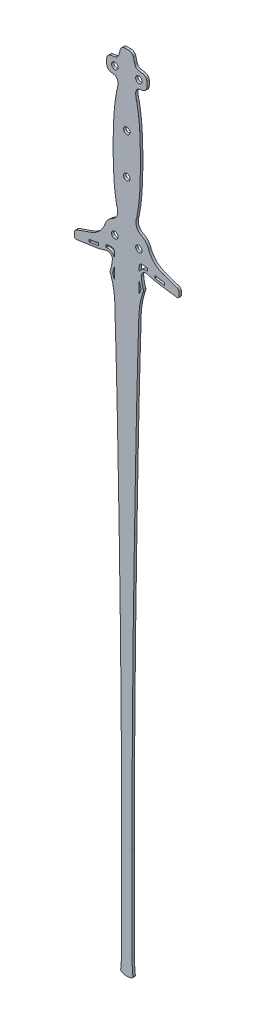
from build123d import *

# Parameters (mm, degrees)
SKETCH_1_R      = 4.005
EXTRUDE_1_DEPTH = 1.5
FILLET_1_R      = 0.2
FILLET_2_R      = 3


with BuildPart() as part:
    # 草图1 → 凸台-拉伸1 (new, symmetric)
    # profile 1 of 2: a face of its own
    with BuildSketch(Plane.XY):
        with BuildLine():
            Line((-51, 3.180546414), (-51, 7.9))
            Line((-51, 7.9), (-62.321401699, 3.937509405))
            ThreePointArc((-62.321401699, 3.937509405), (-64.262330976, 2.47663784), (-65, 0.16207598))
            Line((-65, 0.16207598), (-65, -4.695641523))
            ThreePointArc((-65, -4.695641523), (-64.310942264, -6.206081982), (-62.718569619, -6.675741757))
            Line((-62.718569619, -6.675741757), (-40, -3.446765969))
            ThreePointArc((-40, -3.446765969), (-32.913575006, -2.074422171), (-26, 0))
            ThreePointArc((-26, 0), (-20.389974874, -0.853299832), (-18, -6))
            ThreePointArc((-18, -6), (-18.819913687, -12.424591758), (-20.517307458, -18.674911117))
            ThreePointArc((-20.517307458, -18.674911117), (-20.73865282, -20.013363651), (-20.499895698, -21.348820124))
            ThreePointArc((-20.499895698, -21.348820124), (-16.618295339, -35.457177445), (-15, -50))
            ThreePointArc((-15, -50), (-12.720169014, -129.993004226), (-11, -210.000000002))
            Line((-11, -210.000000002), (-9.559920685, -290.000000002))
            ThreePointArc((-9.559920685, -290.000000002), (-7.264995661, -459.993115498), (-6.5, -630.000000001))
            Line((-6.5, -630.000000001), (-6.5, -745))
            ThreePointArc((-6.5, -745), (-6.775179744, -755.763553595), (-7.6, -766.498984719))
            ThreePointArc((-7.6, -766.498984719), (-7.236288831, -768.028603861), (-6, -769))
            ThreePointArc((-6, -769), (-3.041381265, -769.748287591), (0, -770))
            ThreePointArc((0, -770), (3.041381265, -769.748287591), (6, -769))
            ThreePointArc((6, -769), (7.236288831, -768.028603861), (7.6, -766.498984719))
            ThreePointArc((7.6, -766.498984719), (6.775179744, -755.763553595), (6.5, -745))
            Line((6.5, -745), (6.5, -630.000000001))
            ThreePointArc((6.5, -630.000000001), (7.264995661, -459.993115498), (9.559920685, -290.000000002))
            Line((9.559920685, -290.000000002), (11, -210.000000002))
            ThreePointArc((11, -210.000000002), (12.720169014, -129.993004226), (15, -50))
            ThreePointArc((15, -50), (16.618295339, -35.457177445), (20.499895698, -21.348820124))
            ThreePointArc((20.499895698, -21.348820124), (20.73865282, -20.013363651), (20.517307458, -18.674911117))
            ThreePointArc((20.517307458, -18.674911117), (18.819913687, -12.424591758), (18, -6))
            ThreePointArc((18, -6), (20.389974874, -0.853299832), (26, 0))
            ThreePointArc((26, 0), (32.913575005, -2.074422171), (40, -3.446765969))
            Line((40, -3.446765969), (62.718569618, -6.675741757))
            ThreePointArc((62.718569618, -6.675741757), (64.310942264, -6.206081982), (65, -4.695641522))
            Line((65, -4.695641522), (65, 0.16207598))
            ThreePointArc((65, 0.16207598), (64.262330976, 2.47663784), (62.321401699, 3.937509405))
            Line((62.321401699, 3.937509405), (51, 7.9))
            Line((51, 7.9), (51.000000001, 3.180546413))
            ThreePointArc((51.000000001, 3.180546413), (50.30127228, 1.661767149), (48.693309547, 1.204201057))
            Line((48.693309547, 1.204201057), (47, 1.466969845))
            Line((47, 1.466969845), (47, -1.454343853))
            Line((47, -1.454343853), (40, -0.415285585))
            ThreePointArc((40, -0.415285585), (37.491421313, 0.004431893), (35, 0.516242044))
            Line((35, 0.516242044), (35, 3.527708691))
            ThreePointArc((35, 3.527708691), (30.981370716, 4.607438012), (27.03861346, 5.937799596))
            ThreePointArc((27.03861346, 5.937799596), (26.521743355, 6.122482085), (26, 6.292911543))
            Line((26, 6.292911543), (26, 3.119373591))
            ThreePointArc((26, 3.119373591), (19.646378019, 2.229159578), (15.5, -2.666608246))
            Line((15.5, -2.666608246), (15.5, 6.729179507))
            ThreePointArc((15.5, 6.729179507), (7.913768051, 4.100982185), (1.385208233, -0.571944418))
            ThreePointArc((1.385208233, -0.571944418), (0, -1.129308584), (-1.385208233, -0.571944418))
            ThreePointArc((-1.385208233, -0.571944418), (-7.913768051, 4.100982185), (-15.5, 6.729179507))
            Line((-15.5, 6.729179507), (-15.5, -2.666608246))
            ThreePointArc((-15.5, -2.666608246), (-19.646378019, 2.229159579), (-26, 3.119373591))
            Line((-26, 3.119373591), (-26, 6.292911543))
            ThreePointArc((-26, 6.292911543), (-26.521743355, 6.122482085), (-27.03861346, 5.937799596))
            ThreePointArc((-27.03861346, 5.937799596), (-30.981370716, 4.607438012), (-35, 3.527708691))
            Line((-35, 3.527708691), (-35, 0.516242044))
            ThreePointArc((-35, 0.516242044), (-37.491421313, 0.004431893), (-40, -0.415285585))
            Line((-40, -0.415285585), (-47, -1.454343853))
            Line((-47, -1.454343853), (-47, 1.466969845))
            Line((-47, 1.466969845), (-48.693309546, 1.204201058))
            ThreePointArc((-48.693309546, 1.204201058), (-50.30127228, 1.661767149), (-51, 3.180546414))
        make_face()
        with BuildLine():
            Line((-15.5, -10.864995645), (-15.5, -27.128385604))
            ThreePointArc((-15.5, -27.128385604), (-16.580636881, -23.538373218), (-17.800761691, -19.993340009))
            ThreePointArc((-17.800761691, -19.993340009), (-16.434589273, -15.483557206), (-15.5, -10.864995645))
        make_face(mode=Mode.SUBTRACT)
        with BuildLine():
            ThreePointArc((17.800761691, -19.993340009), (16.580636881, -23.538373218), (15.5, -27.128385604))
            Line((15.5, -27.128385604), (15.5, -10.864995645))
            ThreePointArc((15.5, -10.864995645), (16.434589273, -15.483557206), (17.800761691, -19.993340009))
        make_face(mode=Mode.SUBTRACT)
    # profile 2 of 2: a face of its own
    with BuildSketch(Plane.XY):
        with BuildLine():
            Line((-14.756876386, 214.327554745), (-20.057142461, 213.378857368))
            ThreePointArc((-20.057142461, 213.378857368), (-23.601241939, 211.323509315), (-25, 207.472720745))
            Line((-25, 207.472720745), (-25, 201.326848536))
            ThreePointArc((-25, 201.326848536), (-23.596266659, 197.470122878), (-20.041889066, 195.418002018))
            Line((-20.041889066, 195.418002018), (-16.102952841, 194.723461286))
            ThreePointArc((-16.102952841, 194.723461286), (-12.706668456, 192.852264632), (-11.164076536, 189.29466225))
            ThreePointArc((-11.164076536, 189.29466225), (-11.291808916, 184.077226342), (-12.5, 179))
            ThreePointArc((-12.5, 179), (-14.851607398, 164.0634722), (-16.163752734, 149))
            ThreePointArc((-16.163752734, 149), (-17, 117), (-16.163752734, 85))
            ThreePointArc((-16.163752734, 85), (-14.851607398, 69.9365278), (-12.5, 55))
            ThreePointArc((-12.5, 55), (-11.911130003, 53.083280625), (-11.477761942, 51.125533665))
            ThreePointArc((-11.477761942, 51.125533665), (-12.573101992, 43.602504068), (-17.969256833, 38.24738903))
            ThreePointArc((-17.969256833, 38.24738903), (-23.494373327, 34.013555037), (-27, 28))
            ThreePointArc((-27, 28), (-33.946166681, 16.946166681), (-45, 10))
            Line((-45, 10), (-51, 7.9))
            Line((-51, 7.9), (-51, 3.180546414))
            ThreePointArc((-51, 3.180546414), (-50.30127228, 1.661767149), (-48.693309546, 1.204201058))
            Line((-48.693309546, 1.204201058), (-47, 1.466969845))
            Line((-47, 1.466969845), (-40, 2.55323403))
            ThreePointArc((-40, 2.55323403), (-37.490612357, 2.992303651), (-35, 3.527708691))
            ThreePointArc((-35, 3.527708691), (-30.981370716, 4.607438012), (-27.03861346, 5.937799596))
            ThreePointArc((-27.03861346, 5.937799596), (-26.521743355, 6.122482085), (-26, 6.292911543))
            ThreePointArc((-26, 6.292911543), (-22.157659216, 7.08684126), (-18.234255847, 7.115356189))
            ThreePointArc((-18.234255847, 7.115356189), (-16.862364377, 6.955995296), (-15.5, 6.729179507))
            ThreePointArc((-15.5, 6.729179507), (-7.913768051, 4.100982185), (-1.385208233, -0.571944418))
            ThreePointArc((-1.385208233, -0.571944418), (0, -1.129308584), (1.385208233, -0.571944418))
            ThreePointArc((1.385208233, -0.571944418), (7.913768051, 4.100982185), (15.5, 6.729179507))
            ThreePointArc((15.5, 6.729179507), (16.862364377, 6.955995296), (18.234255847, 7.115356189))
            ThreePointArc((18.234255847, 7.115356189), (22.157659216, 7.086841259), (26, 6.292911543))
            ThreePointArc((26, 6.292911543), (26.521743355, 6.122482085), (27.03861346, 5.937799596))
            ThreePointArc((27.03861346, 5.937799596), (30.981370716, 4.607438012), (35, 3.527708691))
            ThreePointArc((35, 3.527708691), (37.490612358, 2.992303651), (40.000000001, 2.55323403))
            Line((40.000000001, 2.55323403), (47, 1.466969845))
            Line((47, 1.466969845), (48.693309547, 1.204201057))
            ThreePointArc((48.693309547, 1.204201057), (50.30127228, 1.661767149), (51.000000001, 3.180546413))
            Line((51.000000001, 3.180546413), (51, 7.9))
            Line((51, 7.9), (45, 10))
            ThreePointArc((45, 10), (33.946166681, 16.946166681), (27, 28))
            ThreePointArc((27, 28), (23.494373327, 34.013555037), (17.969256833, 38.24738903))
            ThreePointArc((17.969256833, 38.24738903), (12.573101992, 43.602504068), (11.477761942, 51.125533665))
            ThreePointArc((11.477761942, 51.125533665), (11.911130003, 53.083280625), (12.5, 55))
            ThreePointArc((12.5, 55), (14.851607398, 69.9365278), (16.163752734, 85))
            ThreePointArc((16.163752734, 85), (17, 117), (16.163752734, 149))
            ThreePointArc((16.163752734, 149), (14.851607398, 164.0634722), (12.5, 179))
            ThreePointArc((12.5, 179), (11.291808916, 184.077226342), (11.164076536, 189.29466225))
            ThreePointArc((11.164076536, 189.29466225), (12.706668456, 192.852264632), (16.102952841, 194.723461286))
            Line((16.102952841, 194.723461286), (20.041889066, 195.418002018))
            ThreePointArc((20.041889066, 195.418002018), (23.596266659, 197.470122878), (25, 201.326848536))
            Line((25, 201.326848536), (25, 207.472720745))
            ThreePointArc((25, 207.472720745), (23.601241939, 211.323509315), (20.057142461, 213.378857368))
            Line((20.057142461, 213.378857368), (14.756876386, 214.327554745))
            ThreePointArc((14.756876386, 214.327554745), (11.752126247, 215.817694482), (10.016609209, 218.687715465))
            Line((10.016609209, 218.687715465), (8.187739759, 225.545975903))
            ThreePointArc((8.187739759, 225.545975903), (6.045746964, 228.757933134), (2.390330121, 230))
            Line((2.390330121, 230), (-2.390330121, 230))
            ThreePointArc((-2.390330121, 230), (-6.045746964, 228.757933134), (-8.187739759, 225.545975903))
            Line((-8.187739759, 225.545975903), (-10.016609209, 218.687715465))
            ThreePointArc((-10.016609209, 218.687715465), (-11.752126247, 215.817694482), (-14.756876386, 214.327554745))
        make_face()
        with Locations((-15, 22)):
            Circle(SKETCH_1_R, mode=Mode.SUBTRACT)
        with Locations((-15, 204.5)):
            Circle(SKETCH_1_R, mode=Mode.SUBTRACT)
        with Locations((15, 22)):
            Circle(SKETCH_1_R, mode=Mode.SUBTRACT)
        with Locations((0, 92)):
            Circle(SKETCH_1_R, mode=Mode.SUBTRACT)
        with Locations((0, 142)):
            Circle(SKETCH_1_R, mode=Mode.SUBTRACT)
        with Locations((15, 204.5)):
            Circle(SKETCH_1_R, mode=Mode.SUBTRACT)
    extrude(amount=EXTRUDE_1_DEPTH, both=True)

    # 圆角1
    fillet_1_edges = [part.edges().sort_by_distance(p)[0] for p in [
        (-15.5, -27.128385604, 0),
        (-15.5, -10.864995645, 0),
        (15.5, -10.864995645, 0),
        (15.5, -27.128385604, 0),
        (-47, -1.454343853, 0),
        (-35, 0.516242044, 0),
        (-35, 3.527708691, 0),
        (-47, 1.466969845, 0),
        (-26, 3.119373591, 0),
        (-15.5, -2.666608246, 0),
        (-26, 6.292911543, 0),
        (35, 0.516242044, 0),
        (47, -1.454343853, 0),
        (47, 1.466969845, 0),
        (35, 3.527708691, 0),
        (15.5, -2.666608246, 0),
        (26, 3.119373591, 0),
        (26, 6.292911543, 0),
    ]]
    fillet(fillet_1_edges, radius=FILLET_1_R)

    # 圆角2
    fillet_2_edges = [part.edges().sort_by_distance(p)[0] for p in [
        (-17.800761691, -19.993340009, 0),
        (17.800761691, -19.993340009, 0),
        (-15.5, 6.729179507, 0),
        (15.5, 6.729179507, 0),
    ]]
    fillet(fillet_2_edges, radius=FILLET_2_R)


solid = part.part
